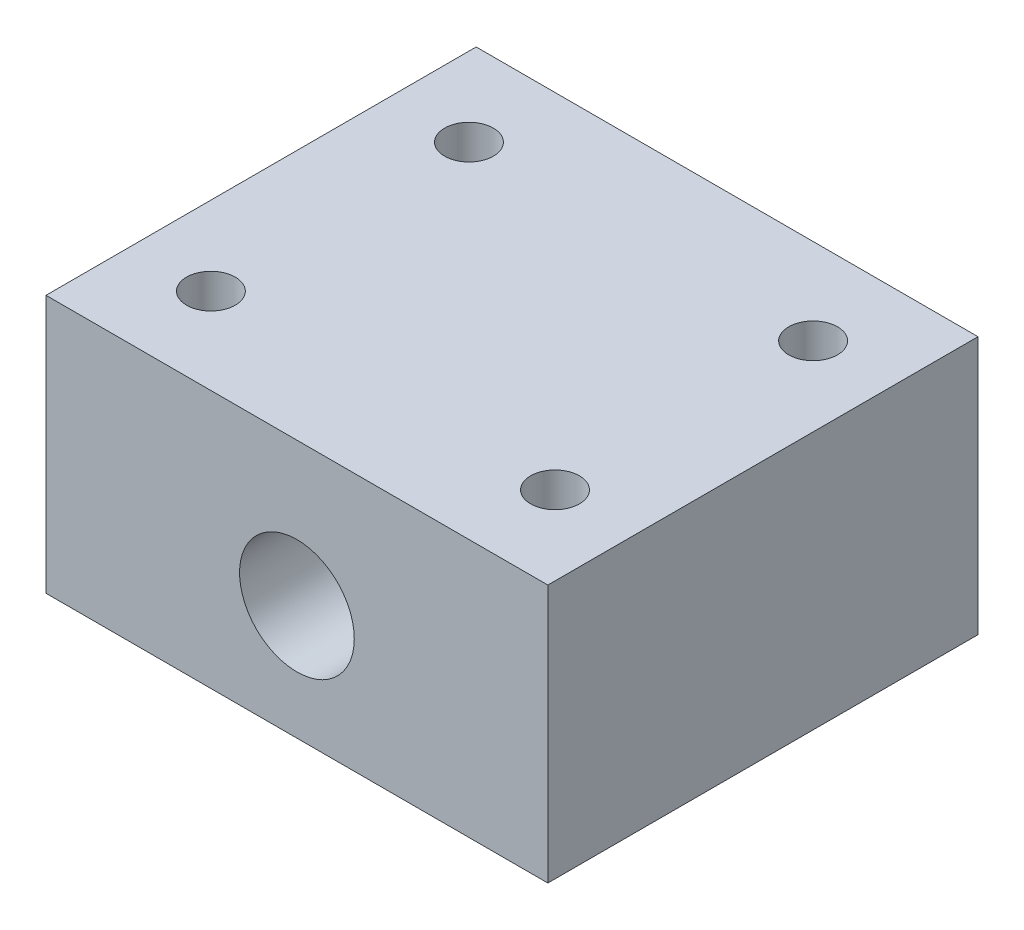
from build123d import *

# Parameters (mm, degrees)
SKETCH2_W           = 35
SKETCH2_H           = 30
BOSS_EXTRUDE1_DEPTH = 18
SKETCH3_R           = 1.7
CUT_EXTRUDE1_DEPTH  = 50.487372127
SKETCH4_R           = 4
CUT_EXTRUDE2_DEPTH  = 50.487372127


with BuildPart() as part:
    # Sketch2 → Boss-Extrude1 (new body)
    with BuildSketch(Plane(origin=(0, 0, 0), x_dir=(1, 0, 0), z_dir=(0, 1, 0))):
        with Locations((17.5, 15)):
            Rectangle(SKETCH2_W, SKETCH2_H)
    extrude(amount=BOSS_EXTRUDE1_DEPTH)

    # Sketch3 → Cut-Extrude1 (cut, through all)
    with BuildSketch(Plane.XZ):
        with Locations(Location((5.5, -24, 0), (0, 0, 270))):
            Circle(SKETCH3_R)
        with Locations(Location((29.5, -24, 0), (0, 0, 90))):
            Circle(SKETCH3_R)
        with Locations(Location((29.5, -6, 0), (0, 0, 270))):
            Circle(SKETCH3_R)
        with Locations(Location((5.5, -6, 0), (0, 0, 90))):
            Circle(SKETCH3_R)
    extrude(amount=-CUT_EXTRUDE1_DEPTH, mode=Mode.SUBTRACT)

    # Sketch4 → Cut-Extrude2 (cut, through all)
    with BuildSketch(Plane.XY):
        with Locations((17.5, 8)):
            Circle(SKETCH4_R)
    extrude(amount=-CUT_EXTRUDE2_DEPTH, mode=Mode.SUBTRACT)


solid = part.part
